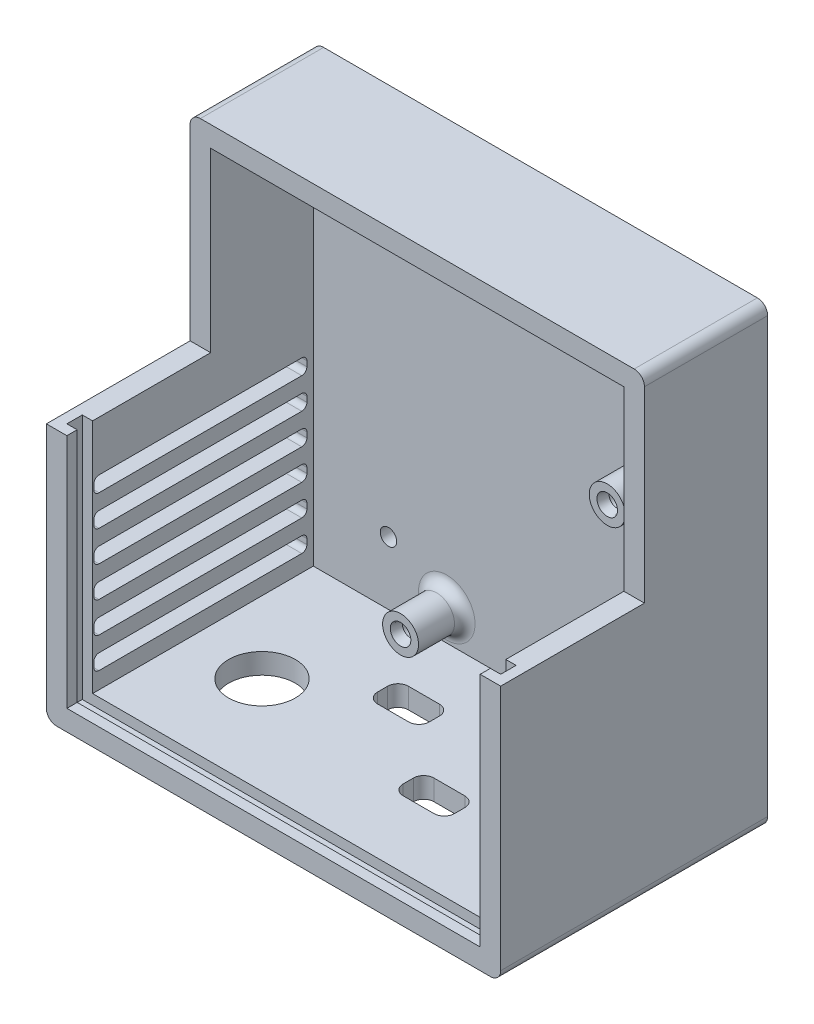
from build123d import *
from OCP.BRepFilletAPI import BRepFilletAPI_MakeChamfer

# Parameters (mm, degrees)
SKETCH1_W           = 88.5
SKETCH1_H           = 88.5
BOSS_EXTRUDE1_DEPTH = 4
SKETCH1_3_W         = 88.5
SKETCH1_3_H         = 88.5
SKETCH1_3_W_2       = 80.5
SKETCH1_3_H_2       = 80.5
SKETCH1_3_R         = 3.5
SKETCH1_3_R_2       = 1.5
BOSS_EXTRUDE2_DEPTH = 9
CHAMFER1_SIZE       = 0.5
CHAMFER1_SIZE2      = 1.866025404
SKETCH4_W           = 88.5
SKETCH4_H           = 88.5
SKETCH4_W_2         = 80.5
SKETCH4_H_2         = 80.5
BOSS_EXTRUDE3_DEPTH = 39
SKETCH5_R           = 6.5
CUT_EXTRUDE1_DEPTH  = 16
FILLET1_R           = 2
FILLET2_R           = 2
FILLET3_R           = 2
FILLET4_R           = 2
FILLET5_R           = 2
FILLET6_R           = 2
FILLET7_R           = 2
CUT_EXTRUDE2_DEPTH  = 10
SKETCH9_W           = 28
SKETCH9_H           = 38.5
CUT_EXTRUDE3_DEPTH  = 88.5
SKETCH13_R          = 1.6
CUT_EXTRUDE5_DEPTH  = 10
SKETCH14_W          = 2
SKETCH14_H          = 3
CUT_EXTRUDE6_DEPTH  = 48
SKETCH15_W          = 2
SKETCH15_H          = 3
CUT_EXTRUDE7_DEPTH  = 48
SKETCH16_W          = 80.5
SKETCH16_H          = 3
CUT_EXTRUDE8_DEPTH  = 2


with BuildPart() as part:
    # Sketch1 → Boss-Extrude1 (new body)
    with BuildSketch(Plane(origin=(0, 0, 0), x_dir=(0, 1, 0), z_dir=(0, 0, 1))):
        Rectangle(SKETCH1_W, SKETCH1_H)
    extrude(amount=-BOSS_EXTRUDE1_DEPTH)

    # Sketch1<3> → Boss-Extrude2 (add)
    # profile 1 of 4: a face of its own
    with BuildSketch(Plane(origin=(0, 0, 0), x_dir=(0, 1, 0), z_dir=(0, 0, 1))):
        Rectangle(SKETCH1_3_W, SKETCH1_3_H)
        Rectangle(SKETCH1_3_W_2, SKETCH1_3_H_2, mode=Mode.SUBTRACT)
    # profile 2 of 4: a face of its own
    with BuildSketch(Plane(origin=(0, 0, 0), x_dir=(0, 1, 0), z_dir=(0, 0, 1))):
        with Locations((-34.25, 14.25)):
            Circle(SKETCH1_3_R)
        with Locations((-34.25, 14.25)):
            Circle(SKETCH1_3_R_2, mode=Mode.SUBTRACT)
    # profile 3 of 4: a face of its own
    with BuildSketch(Plane(origin=(0, 0, 0), x_dir=(0, 1, 0), z_dir=(0, 0, 1))):
        with Locations((34.25, 14.25)):
            Circle(SKETCH1_3_R)
        with Locations((34.25, 14.25)):
            Circle(SKETCH1_3_R_2, mode=Mode.SUBTRACT)
    # profile 4 of 4: a face of its own
    with BuildSketch(Plane(origin=(0, 0, 0), x_dir=(0, 1, 0), z_dir=(0, 0, 1))):
        with Locations((7.75, -26)):
            Circle(SKETCH1_3_R)
        with Locations((7.75, -26)):
            Circle(SKETCH1_3_R_2, mode=Mode.SUBTRACT)
    extrude(amount=BOSS_EXTRUDE2_DEPTH)

    # Chamfer1: one chamfer whose edges measure the first distance from different faces: ONE call of the kernel's chamfer builder (chamfer() names one face for all edges)
    chamfer1_edges_1 = [part.edges().sort_by_distance(p)[0] for p in [
        (-14.25, -35.75, 9),
    ]]
    chamfer1_side_1 = [part.faces().sort_by_distance(p)[0] for p in [
        (-14.25, -37.651005051, 9),
    ]]
    chamfer1_edges_2 = [part.edges().sort_by_distance(p)[0] for p in [
        (26, 6.25, 9),
    ]]
    chamfer1_side_2 = [part.faces().sort_by_distance(p)[0] for p in [
        (26, 4.348994949, 9),
    ]]
    chamfer1_edges_3 = [part.edges().sort_by_distance(p)[0] for p in [
        (-14.25, 32.75, 9),
    ]]
    chamfer1_side_3 = [part.faces().sort_by_distance(p)[0] for p in [
        (-14.25, 30.848994949, 9),
    ]]
    chamfer1 = BRepFilletAPI_MakeChamfer(part.part.solid().wrapped)
    for e in chamfer1_edges_1:
        chamfer1.Add(CHAMFER1_SIZE, CHAMFER1_SIZE2, e.wrapped, chamfer1_side_1[0].wrapped)  # the first distance lies on this face
    for e in chamfer1_edges_2:
        chamfer1.Add(CHAMFER1_SIZE, CHAMFER1_SIZE2, e.wrapped, chamfer1_side_2[0].wrapped)  # the first distance lies on this face
    for e in chamfer1_edges_3:
        chamfer1.Add(CHAMFER1_SIZE, CHAMFER1_SIZE2, e.wrapped, chamfer1_side_3[0].wrapped)  # the first distance lies on this face
    add(Compound.cast(chamfer1.Shape()), mode=Mode.REPLACE)

    # Sketch4 → Boss-Extrude3 (add)
    with BuildSketch(Plane.XY.offset(9)):
        Rectangle(SKETCH4_W, SKETCH4_H)
        Rectangle(SKETCH4_W_2, SKETCH4_H_2, mode=Mode.SUBTRACT)
    extrude(amount=BOSS_EXTRUDE3_DEPTH)

    # Sketch5 → Cut-Extrude1 (cut)
    with BuildSketch(Plane.XZ.offset(44.25)):
        with Locations((-26.25, 24)):
            Circle(SKETCH5_R)
        with BuildLine():
            Line((7.25, 30), (13.25, 30))
            ThreePointArc((13.25, 30), (14.664213562, 29.414213562), (15.25, 28))
            Line((15.25, 28), (15.25, 26))
            ThreePointArc((15.25, 26), (14.664213562, 24.585786438), (13.25, 24))
            Line((13.25, 24), (7.25, 24))
            ThreePointArc((7.25, 24), (5.835786438, 24.585786438), (5.25, 26))
            Line((5.25, 26), (5.25, 28))
            ThreePointArc((5.25, 28), (5.835786438, 29.414213562), (7.25, 30))
        make_face()
        with BuildLine():
            Line((-10.75, 17), (-4.67, 17))
            ThreePointArc((-4.67, 17), (-3.255786438, 16.414213562), (-2.67, 15))
            Line((-2.67, 15), (-2.67, 13))
            ThreePointArc((-2.67, 13), (-3.255786438, 11.585786438), (-4.67, 11))
            Line((-4.67, 11), (-10.75, 11))
            ThreePointArc((-10.75, 11), (-12.164213562, 11.585786438), (-12.75, 13))
            Line((-12.75, 13), (-12.75, 15))
            ThreePointArc((-12.75, 15), (-12.164213562, 16.414213562), (-10.75, 17))
        make_face()
    extrude(amount=-CUT_EXTRUDE1_DEPTH, mode=Mode.SUBTRACT)

    # Fillet1
    fillet1_edges = [part.edges().sort_by_distance(p)[0] for p in [
        (44.25, -44.25, 22),
    ]]
    fillet(fillet1_edges, radius=FILLET1_R)

    # Fillet2
    fillet2_edges = [part.edges().sort_by_distance(p)[0] for p in [
        (-44.25, -44.25, 22),
    ]]
    fillet(fillet2_edges, radius=FILLET2_R)

    # Fillet3
    fillet3_edges = [part.edges().sort_by_distance(p)[0] for p in [
        (44.25, 44.25, 22),
    ]]
    fillet(fillet3_edges, radius=FILLET3_R)

    # Fillet4
    fillet4_edges = [part.edges().sort_by_distance(p)[0] for p in [
        (-44.25, 44.25, 22),
    ]]
    fillet(fillet4_edges, radius=FILLET4_R)

    # Fillet5
    fillet5_edges = [part.edges().sort_by_distance(p)[0] for p in [
        (26, 4.25, 0),
    ]]
    fillet(fillet5_edges, radius=FILLET5_R)

    # Fillet6
    fillet6_edges = [part.edges().sort_by_distance(p)[0] for p in [
        (-14.25, -37.75, 0),
    ]]
    fillet(fillet6_edges, radius=FILLET6_R)

    # Fillet7
    fillet7_edges = [part.edges().sort_by_distance(p)[0] for p in [
        (-14.25, 30.75, 0),
    ]]
    fillet(fillet7_edges, radius=FILLET7_R)

    # Sketch6 → Cut-Extrude2 (cut)
    with BuildSketch(Plane(origin=(-44.25, 0, 0), x_dir=(0, -1, 0), z_dir=(-1, 0, 0))):
        with BuildLine():
            Line((36, 1.25), (35, 1.25))
            ThreePointArc((35, 1.25), (34.292893219, 1.542893219), (34, 2.25))
            Line((34, 2.25), (34, 41.75))
            ThreePointArc((34, 41.75), (34.292893219, 42.457106781), (35, 42.75))
            Line((35, 42.75), (36, 42.75))
            ThreePointArc((36, 42.75), (36.707106781, 42.457106781), (37, 41.75))
            Line((37, 41.75), (37, 2.25))
            ThreePointArc((37, 2.25), (36.707106781, 1.542893219), (36, 1.25))
        make_face()
        with BuildLine():
            Line((31, 2.25), (31, 41.75))
            ThreePointArc((31, 41.75), (30.707106781, 42.457106781), (30, 42.75))
            Line((30, 42.75), (29, 42.75))
            ThreePointArc((29, 42.75), (28.292893219, 42.457106781), (28, 41.75))
            Line((28, 41.75), (28, 2.25))
            ThreePointArc((28, 2.25), (28.292893219, 1.542893219), (29, 1.25))
            Line((29, 1.25), (30, 1.25))
            ThreePointArc((30, 1.25), (30.707106781, 1.542893219), (31, 2.25))
        make_face()
        with BuildLine():
            Line((25, 2.25), (25, 41.75))
            ThreePointArc((25, 41.75), (24.707106781, 42.457106781), (24, 42.75))
            Line((24, 42.75), (23, 42.75))
            ThreePointArc((23, 42.75), (22.292893219, 42.457106781), (22, 41.75))
            Line((22, 41.75), (22, 2.25))
            ThreePointArc((22, 2.25), (22.292893219, 1.542893219), (23, 1.25))
            Line((23, 1.25), (24, 1.25))
            ThreePointArc((24, 1.25), (24.707106781, 1.542893219), (25, 2.25))
        make_face()
        with BuildLine():
            Line((19, 2.25), (19, 41.75))
            ThreePointArc((19, 41.75), (18.707106781, 42.457106781), (18, 42.75))
            Line((18, 42.75), (17, 42.75))
            ThreePointArc((17, 42.75), (16.292893219, 42.457106781), (16, 41.75))
            Line((16, 41.75), (16, 2.25))
            ThreePointArc((16, 2.25), (16.292893219, 1.542893219), (17, 1.25))
            Line((17, 1.25), (18, 1.25))
            ThreePointArc((18, 1.25), (18.707106781, 1.542893219), (19, 2.25))
        make_face()
        with BuildLine():
            Line((13, 2.25), (13, 41.75))
            ThreePointArc((13, 41.75), (12.707106781, 42.457106781), (12, 42.75))
            Line((12, 42.75), (11, 42.75))
            ThreePointArc((11, 42.75), (10.292893219, 42.457106781), (10, 41.75))
            Line((10, 41.75), (10, 2.25))
            ThreePointArc((10, 2.25), (10.292893219, 1.542893219), (11, 1.25))
            Line((11, 1.25), (12, 1.25))
            ThreePointArc((12, 1.25), (12.707106781, 1.542893219), (13, 2.25))
        make_face()
        with BuildLine():
            Line((7, 2.25), (7, 41.75))
            ThreePointArc((7, 41.75), (6.707106781, 42.457106781), (6, 42.75))
            Line((6, 42.75), (5, 42.75))
            ThreePointArc((5, 42.75), (4.292893219, 42.457106781), (4, 41.75))
            Line((4, 41.75), (4, 2.25))
            ThreePointArc((4, 2.25), (4.292893219, 1.542893219), (5, 1.25))
            Line((5, 1.25), (6, 1.25))
            ThreePointArc((6, 1.25), (6.707106781, 1.542893219), (7, 2.25))
        make_face()
    extrude(amount=-CUT_EXTRUDE2_DEPTH, mode=Mode.SUBTRACT)

    # Sketch9 → Cut-Extrude3 (cut)
    with BuildSketch(Plane.ZY.offset(44.25)):
        with Locations((34, 25)):
            Rectangle(SKETCH9_W, SKETCH9_H)
    extrude(amount=-CUT_EXTRUDE3_DEPTH, mode=Mode.SUBTRACT)

    # Sketch13 → Cut-Extrude5 (cut)
    with BuildSketch(Plane(origin=(0, 0, -4), x_dir=(1, 0, 0), z_dir=(0, 0, -1))):
        with Locations((-25.61, 28)):
            Circle(SKETCH13_R)
        with Locations((10.19, 28)):
            Circle(SKETCH13_R)
        with Locations((-25.61, -28)):
            Circle(SKETCH13_R)
        with Locations((10.19, -28)):
            Circle(SKETCH13_R)
    extrude(amount=-CUT_EXTRUDE5_DEPTH, mode=Mode.SUBTRACT)

    # Sketch14 → Cut-Extrude6 (cut)
    with BuildSketch(Plane(origin=(0, 5.75, 0), x_dir=(-1, 0, 0), z_dir=(0, 1, 0))):
        with Locations((-41.25, 44.5)):
            Rectangle(SKETCH14_W, SKETCH14_H)
    extrude(amount=-CUT_EXTRUDE6_DEPTH, mode=Mode.SUBTRACT)

    # Sketch15 → Cut-Extrude7 (cut)
    with BuildSketch(Plane(origin=(0, 5.75, 0), x_dir=(-1, 0, 0), z_dir=(0, 1, 0))):
        with Locations((41.25, 44.5)):
            Rectangle(SKETCH15_W, SKETCH15_H)
    extrude(amount=-CUT_EXTRUDE7_DEPTH, mode=Mode.SUBTRACT)

    # Sketch16 → Cut-Extrude8 (cut)
    with BuildSketch(Plane(origin=(0, -40.25, 0), x_dir=(-1, 0, 0), z_dir=(0, 1, 0))):
        with Locations((0, 44.5)):
            Rectangle(SKETCH16_W, SKETCH16_H)
    extrude(amount=-CUT_EXTRUDE8_DEPTH, mode=Mode.SUBTRACT)


solid = part.part
